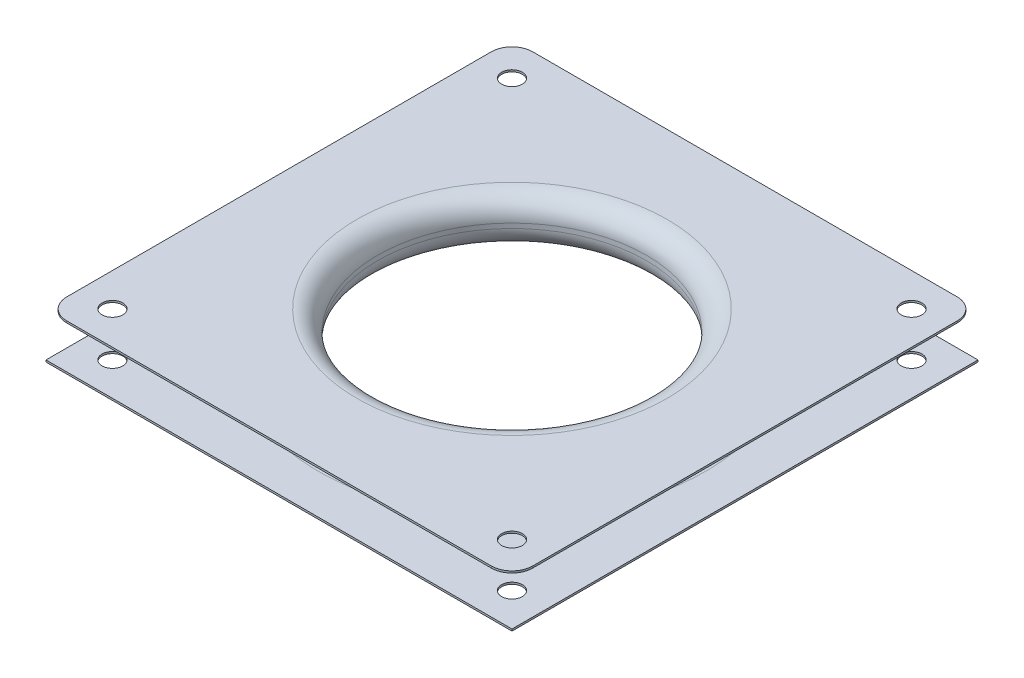
from build123d import *

# Parameters (mm, degrees)
SKETCH1_W           = 94.5
SKETCH1_H           = 94.5
SKETCH1_R           = 27.25
SKETCH1_R_2         = 2.1
BOSS_EXTRUDE1_DEPTH = 9.35
FILLET1_R           = 4.2


with BuildPart() as part:
    # Sketch1 → Boss-Extrude1 (new body)
    with BuildSketch(Plane(origin=(0, 0, 0), x_dir=(1, 0, 0), z_dir=(0, 1, 0))):
        Rectangle(SKETCH1_W, SKETCH1_H)
        with Locations(Location((0, 0, 0), (0, 0, 270))):
            Circle(SKETCH1_R, mode=Mode.SUBTRACT)
        with Locations(Location((-40.513, 40.513, 0), (0, 0, 270))):
            Circle(SKETCH1_R_2, mode=Mode.SUBTRACT)
        with Locations(Location((40.513, 40.513, 0), (0, 0, 270))):
            Circle(SKETCH1_R_2, mode=Mode.SUBTRACT)
        with Locations(Location((40.513, -40.513, 0), (0, 0, 270))):
            Circle(SKETCH1_R_2, mode=Mode.SUBTRACT)
        with Locations(Location((-40.513, -40.513, 0), (0, 0, 270))):
            Circle(SKETCH1_R_2, mode=Mode.SUBTRACT)
    extrude(amount=BOSS_EXTRUDE1_DEPTH)

    # Sketch3 → Cut-Revolve1 (revolve, cut)
    with BuildSketch(Plane.XY, mode=Mode.PRIVATE) as cut_revolve1_sk:
        Polygon((-47.25, 8.969), (-35, 8.969), (-35, 0.381), (-47.25, 0.381), (-68.714160929, 0.381), (-68.714160929, 8.969), align=None)
    revolve(cut_revolve1_sk.sketch.rotate(Axis((0, 9.35, 0), (0, -1, 0)), 270), axis=Axis((0, 9.35, 0), (0, -1, 0)), mode=Mode.SUBTRACT)

    # Fillet1
    fillet1_edges = [part.edges().sort_by_distance(p)[0] for p in [
        (0, 0, -27.25),
        (0, 9.35, -27.25),
        (0, 0.381, -35),
        (0, 8.969, -35),
        (47.25, 9.1595, 47.25),
        (-47.25, 9.1595, 47.25),
        (-47.25, 9.1595, -47.25),
        (47.25, 9.1595, -47.25),
    ]]
    fillet(fillet1_edges, radius=FILLET1_R)


solid = part.part
